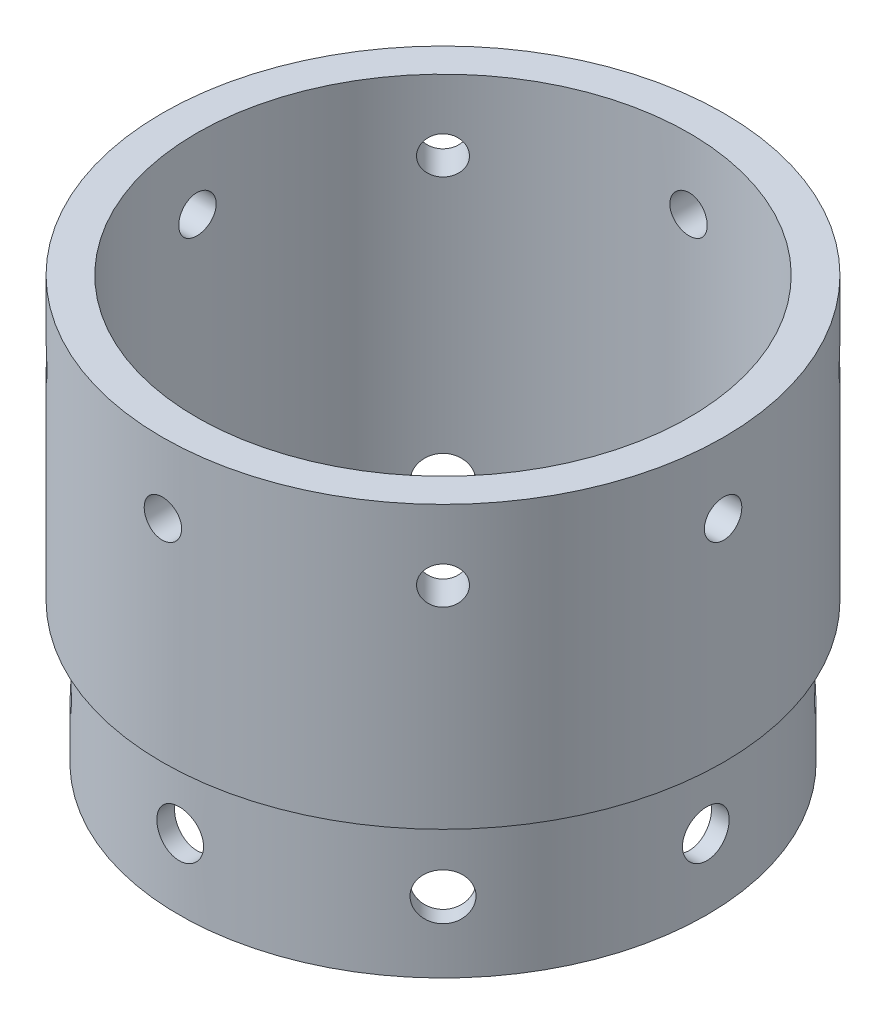
from build123d import *

# Parameters (mm, degrees)
CIRPATTERN1_COUNT = 8


with BuildPart() as part:
    # Sketch1 → Revolve1 (revolve)
    with BuildSketch(Plane.XY, mode=Mode.PRIVATE) as revolve1_sk:
        Polygon((47.625, 0), (47.625, 25.4), (50.673, 25.4), (50.673, 76.2), (44.45, 76.2), (44.45, 0), align=None)
    revolve(revolve1_sk.sketch.rotate(Axis((0, 77.848391372, 0), (0, -1, 0)), 180), axis=Axis((0, 77.848391372, 0), (0, -1, 0)))

    # Sketch4 → 5/16 Clearance Hole1 (revolve, cut)
    with BuildSketch(Plane(origin=(0, 12.7, 50.673), x_dir=(0, -1, 0), z_dir=(1, 0, 0))):
        Polygon((0, 0), (0, 19.304), (4.2164, 16.770531286), (4.2164, 0), align=None)
    f_5_16_clearance_hole1 = revolve(axis=Axis((0, 12.7, 57.023), (0, 0, -1)), mode=Mode.SUBTRACT)

    # Sketch5 → 1/4 Clearance Hole1 (revolve, cut)
    with BuildSketch(Plane(origin=(0, 63.5, 50.673), x_dir=(0, -1, 0), z_dir=(1, 0, 0))):
        Polygon((0, 0), (0, 16.51), (3.3782, 14.480172657), (3.3782, 0), align=None)
    f_1_4_clearance_hole1 = revolve(axis=Axis((0, 63.5, 57.023), (0, 0, -1)), mode=Mode.SUBTRACT)

    # CirPattern1: 5/16 Clearance Hole1, 1/4 Clearance Hole1 ×8 about axis
    cirpattern1_axis = Axis((0, 77.848391372, 0), (0, 1, 0))
    add([f_5_16_clearance_hole1.rotate(cirpattern1_axis, i * 360 / CIRPATTERN1_COUNT) for i in range(1, CIRPATTERN1_COUNT)], mode=Mode.SUBTRACT)
    add([f_1_4_clearance_hole1.rotate(cirpattern1_axis, i * 360 / CIRPATTERN1_COUNT) for i in range(1, CIRPATTERN1_COUNT)], mode=Mode.SUBTRACT)


solid = part.part
